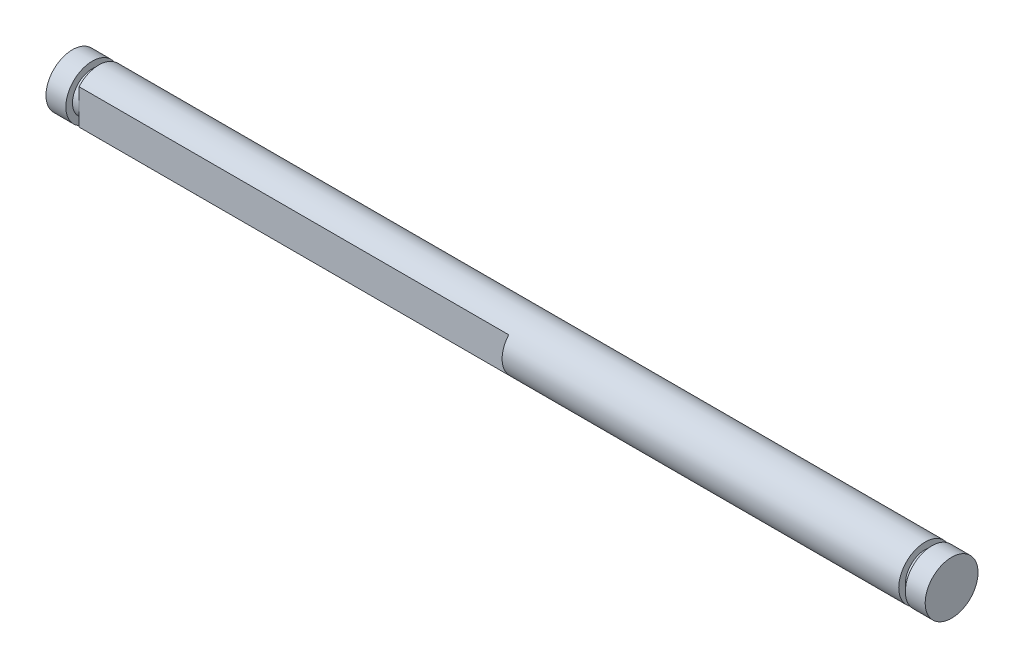
from build123d import *

# Parameters (mm, degrees)
CORTAR_EXTRUIR1_DEPTH      = 67.740167815
CORTAR_EXTRUIR1_DEPTH_BACK = 67.740167815
CROQUIS2_W                 = 65
CROQUIS2_H                 = 1


with BuildPart() as part:
    # Croquis1 → Revolución1 (revolve)
    with BuildSketch(Plane(origin=(0, 0, 0), x_dir=(1, 0, 0), z_dir=(0, 1, 0)), mode=Mode.PRIVATE) as revoluci_n1_sk:
        Polygon((-66.5, 0), (-66.5, 4), (-63.5, 4), (-63.5, 3), (-62.5, 3), (-62.5, 4), (62.5, 4), (62.5, 3), (63.5, 3), (63.5, 4), (66.5, 4), (66.5, 0), align=None)
    revolve(revoluci_n1_sk.sketch.rotate(Axis((-66.5, 0, 0), (1, 0, 0)), 180), axis=Axis((-66.5, 0, 0), (1, 0, 0)))

    # Croquis2 → Cortar-Extruir1 (cut, two sides: drawn at the far end of the back side and taken through both)
    with BuildSketch(Plane(origin=(0, 0, 0), x_dir=(1, 0, 0), z_dir=(0, 1, 0)).offset(-CORTAR_EXTRUIR1_DEPTH_BACK)):
        with Locations((-30, -3.5)):
            Rectangle(CROQUIS2_W, CROQUIS2_H)
    extrude(amount=CORTAR_EXTRUIR1_DEPTH + CORTAR_EXTRUIR1_DEPTH_BACK, mode=Mode.SUBTRACT)


solid = part.part
